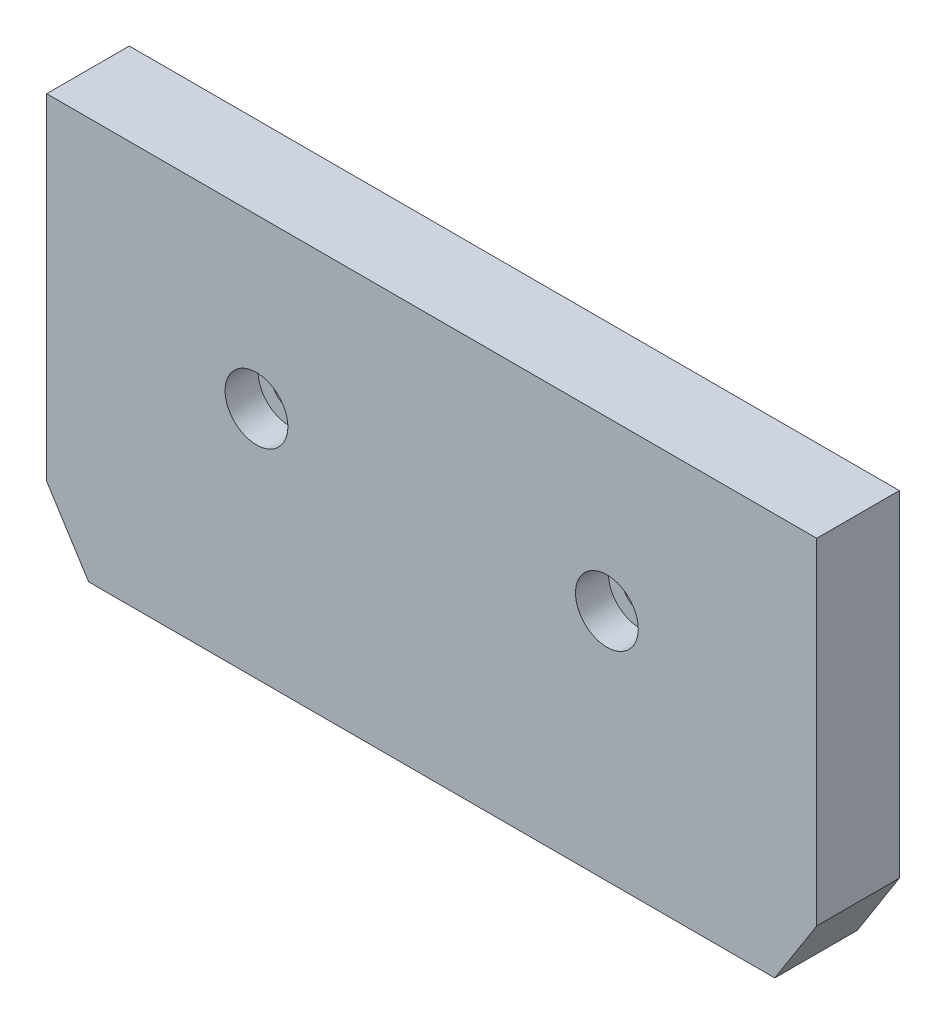
from build123d import *

# Parameters (mm, degrees)
SKETCH4_W           = 93.22
SKETCH4_H           = 40.64
BOSS_EXTRUDE1_DEPTH = 10
SKETCH5_R           = 3.8
CUT_EXTRUDE1_DEPTH  = 3.9878
SKETCH6_R           = 2.05
CUT_EXTRUDE2_DEPTH  = 7.7978
SKETCH7_R           = 2.05
CUT_EXTRUDE5_DEPTH  = 7.7978


with BuildPart() as part:
    # Sketch4 → Boss-Extrude1 (new body)
    with BuildSketch(Plane.XY):
        Polygon((186.44, -13.916292355), (181.36, -21.916292355), (139.83, -21.916292355), (98.3, -21.916292355), (93.22, -13.916292355), align=None)
        with Locations((139.83, 6.403707645)):
            Rectangle(SKETCH4_W, SKETCH4_H)
    extrude(amount=BOSS_EXTRUDE1_DEPTH)

    # Sketch5 → Cut-Extrude1 (cut)
    with BuildSketch(Plane.XY.offset(10)):
        with Locations((118.62, 6.403707645)):
            Circle(SKETCH5_R)
        with Locations((161.04, 6.403707645)):
            Circle(SKETCH5_R)
    extrude(amount=-CUT_EXTRUDE1_DEPTH, mode=Mode.SUBTRACT)

    # Sketch6 → Cut-Extrude2 (cut)
    with BuildSketch(Plane.XY.offset(6.0122)):
        with Locations((118.62, 6.403707645)):
            Circle(SKETCH6_R)
    extrude(amount=-CUT_EXTRUDE2_DEPTH, mode=Mode.SUBTRACT)

    # Sketch7 → Cut-Extrude5 (cut)
    with BuildSketch(Plane.XY.offset(6.0122)):
        with Locations((161.04, 6.403707645)):
            Circle(SKETCH7_R)
    extrude(amount=-CUT_EXTRUDE5_DEPTH, mode=Mode.SUBTRACT)


solid = part.part
